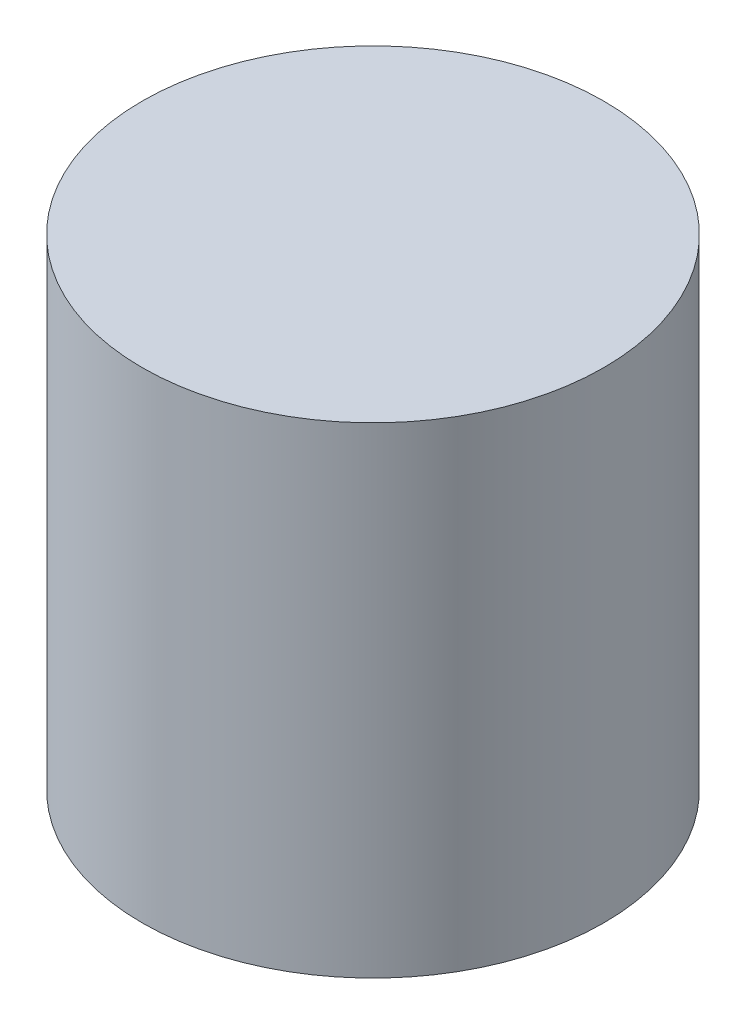
from build123d import *

# Parameters (mm, degrees)
SKETCH1_R           = 4.8
BOSS_EXTRUDE1_DEPTH = 10


with BuildPart() as part:
    # Sketch1 → Boss-Extrude1 (new body)
    with BuildSketch(Plane(origin=(0, 0, 0), x_dir=(1, 0, 0), z_dir=(0, 1, 0))):
        with Locations(Location((0, 0, 0), (0, 0, 270))):
            Circle(SKETCH1_R)
    extrude(amount=BOSS_EXTRUDE1_DEPTH)


solid = part.part
